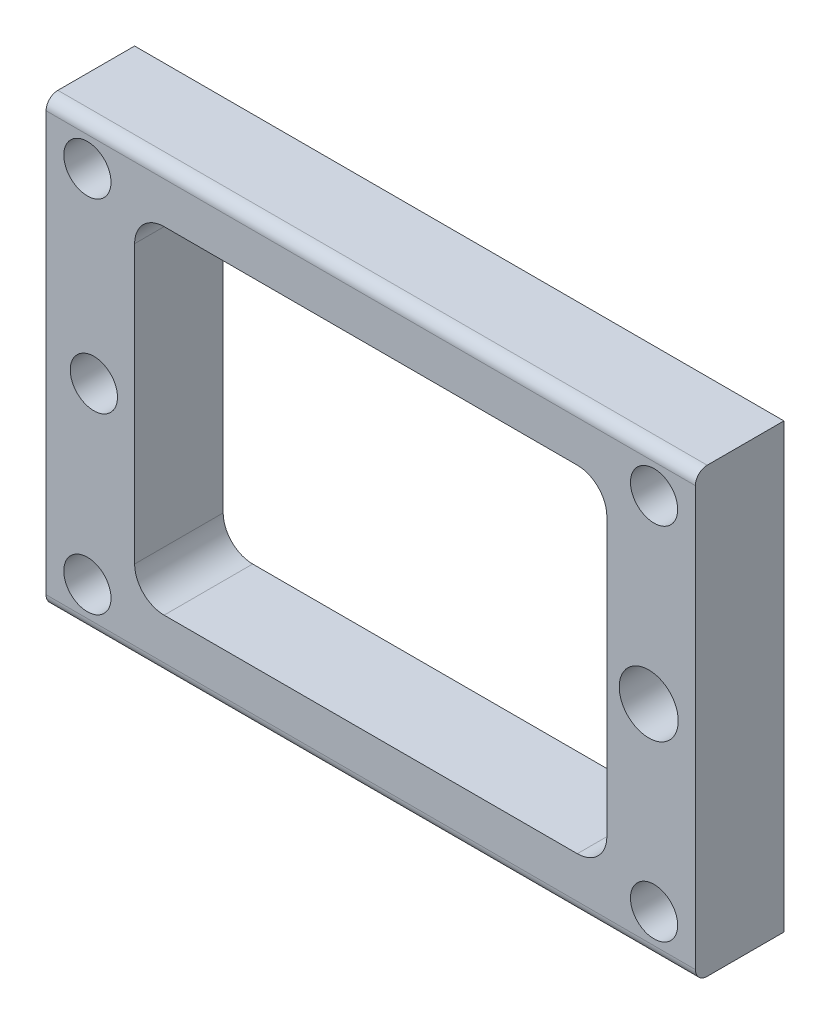
from build123d import *

# Parameters (mm, degrees)
CROQUIS2_W              = 110
CROQUIS2_H              = 75
CROQUIS2_R              = 2
CROQUIS2_R_2            = 1.997516107
SALIENTE_EXTRUIR1_DEPTH = 15
CROQUIS3_R              = 4
CORTAR_EXTRUIR1_DEPTH   = 6
REDONDEO2_R             = 2
CROQUIS4_R              = 3.5
CROQUIS4_R_2            = 3
CORTAR_EXTRUIR8_DEPTH   = 15
CROQUIS5_R              = 3.701474701
SALIENTE_EXTRUIR2_DEPTH = 15
CROQUIS7_R              = 4
CROQUIS7_R_2            = 5
CORTAR_EXTRUIR9_DEPTH   = 15


with BuildPart() as part:
    # Croquis2 → Saliente-Extruir1 (new body)
    with BuildSketch(Plane.XY):
        with Locations((-693.862272549, 896.557366956)):
            Rectangle(CROQUIS2_W, CROQUIS2_H)
        with Locations((-741.862272549, 866.057366956)):
            Circle(CROQUIS2_R, mode=Mode.SUBTRACT)
        with Locations((-645.862272549, 866.057366956)):
            Circle(CROQUIS2_R, mode=Mode.SUBTRACT)
        with BuildLine():
            Line((-728.862272549, 925.057366956), (-706.362272549, 925.057366956))
            Line((-706.362272549, 925.057366956), (-681.362272549, 925.057366956))
            Line((-681.362272549, 925.057366956), (-658.862272549, 925.057366956))
            ThreePointArc((-658.862272549, 925.057366956), (-655.326738643, 923.592900862), (-653.862272549, 920.057366956))
            Line((-653.862272549, 920.057366956), (-653.862272549, 873.057366956))
            ThreePointArc((-653.862272549, 873.057366956), (-655.326738643, 869.52183305), (-658.862272549, 868.057366956))
            Line((-658.862272549, 868.057366956), (-681.362272549, 868.057366956))
            Line((-681.362272549, 868.057366956), (-706.362272549, 868.057366956))
            Line((-706.362272549, 868.057366956), (-728.862272549, 868.057366956))
            ThreePointArc((-728.862272549, 868.057366956), (-732.397806455, 869.52183305), (-733.862272549, 873.057366956))
            Line((-733.862272549, 873.057366956), (-733.862272549, 920.057366956))
            ThreePointArc((-733.862272549, 920.057366956), (-732.397806455, 923.592900862), (-728.862272549, 925.057366956))
        make_face(mode=Mode.SUBTRACT)
        with Locations((-741.862272549, 927.057366956)):
            Circle(CROQUIS2_R, mode=Mode.SUBTRACT)
        with Locations((-645.862272549, 927.057366956)):
            Circle(CROQUIS2_R_2, mode=Mode.SUBTRACT)
    extrude(amount=SALIENTE_EXTRUIR1_DEPTH)

    # Croquis3 → Cortar-Extruir1 (cut)
    with BuildSketch(Plane.XY.offset(15)):
        with Locations((-645.862272549, 927.057366956)):
            Circle(CROQUIS3_R)
        with Locations((-645.862272549, 866.057366956)):
            Circle(CROQUIS3_R)
        with Locations((-741.862272549, 866.057366956)):
            Circle(CROQUIS3_R)
        with Locations((-741.862272549, 927.057366956)):
            Circle(CROQUIS3_R)
    extrude(amount=-CORTAR_EXTRUIR1_DEPTH, mode=Mode.SUBTRACT)

    # Redondeo2
    redondeo2_edges = [part.edges().sort_by_distance(p)[0] for p in [
        (-693.862272549, 859.057366956, 15),
        (-693.862272549, 934.057366956, 15),
    ]]
    fillet(redondeo2_edges, radius=REDONDEO2_R)

    # Croquis4 → Cortar-Extruir8 (cut)
    with BuildSketch(Plane.XY.offset(15)):
        with Locations((-736.862272549, 896.557366956)):
            Circle(CROQUIS4_R)
        with Locations((-642.862272549, 896.557366956)):
            Circle(CROQUIS4_R_2)
    extrude(amount=-CORTAR_EXTRUIR8_DEPTH, mode=Mode.SUBTRACT)

    # Croquis5 → Saliente-Extruir2 (add)
    with BuildSketch(Plane.XY.offset(15)):
        with Locations((-642.862272549, 896.557366956)):
            Circle(CROQUIS5_R)
        with BuildLine():
            Line((-733.862272549, 893.78924565), (-733.862272549, 899.325488262))
            ThreePointArc((-733.862272549, 899.325488262), (-740.944244568, 896.557366956), (-733.862272549, 893.78924565))
        make_face()
    extrude(amount=-SALIENTE_EXTRUIR2_DEPTH)

    # Croquis7 → Cortar-Extruir9 (cut)
    with BuildSketch(Plane.XY.offset(15)):
        with Locations((-740.766439288, 896.084665271)):
            Circle(CROQUIS7_R)
        with Locations((-646.766439288, 896.084665271)):
            Circle(CROQUIS7_R_2)
    extrude(amount=-CORTAR_EXTRUIR9_DEPTH, mode=Mode.SUBTRACT)


solid = part.part
